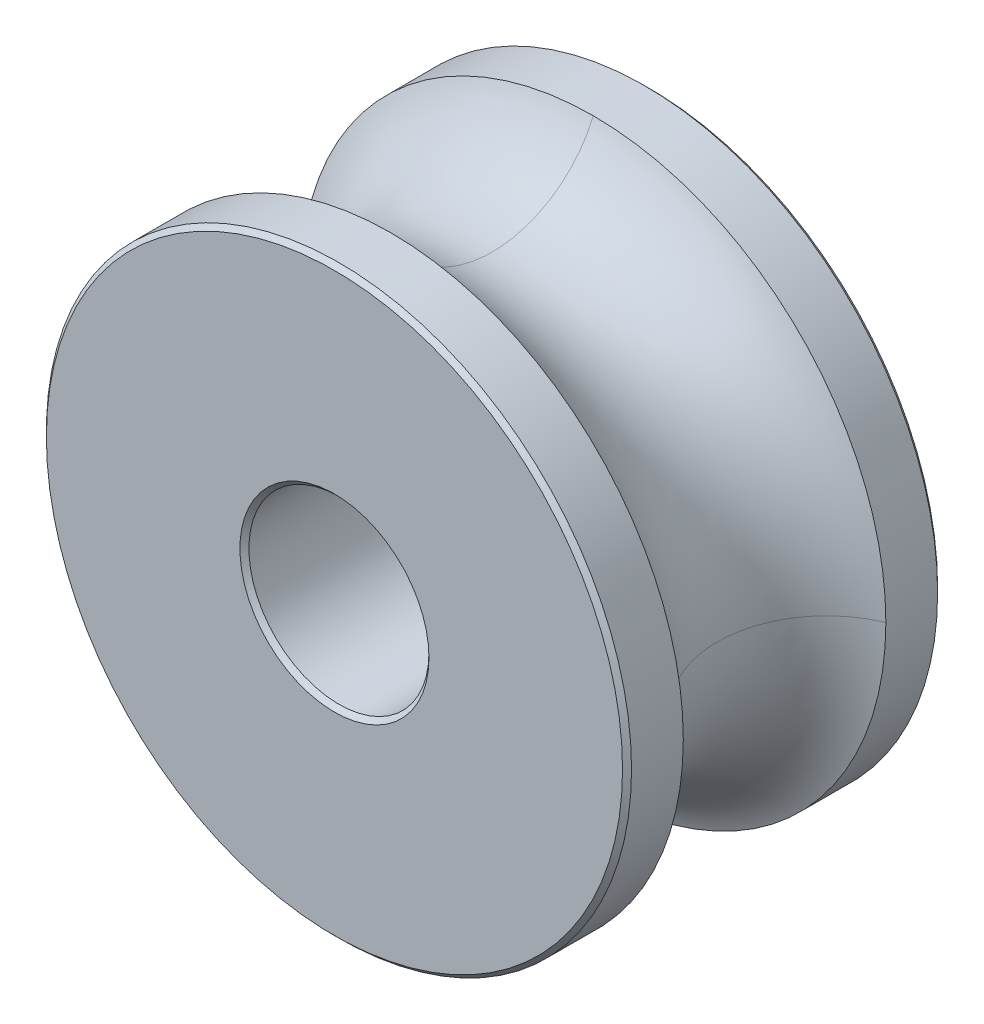
from build123d import *

# Parameters (mm, degrees)
SKETCH_1_R      = 6.5
SKETCH_1_R_2    = 2
EXTRUDE_1_DEPTH = 3.5
CHAMFER_1_SIZE  = 0.1


with BuildPart() as part:
    # 草图1 → 凸台-拉伸1 (new, symmetric)
    with BuildSketch(Plane.XY):
        Circle(SKETCH_1_R)
        Circle(SKETCH_1_R_2, mode=Mode.SUBTRACT)
    extrude(amount=EXTRUDE_1_DEPTH, both=True)

    # 切除-扫描1: sweep along a curve in space
    with BuildLine() as sweep_1_path:
        ThreePointArc((6.5, 0, -3.5), (4.596194078, 4.596194078, -3.5), (0, 6.5, -3.5))
        ThreePointArc((0, 6.5, -3.5), (-4.596194078, 4.596194078, -3.5), (-6.5, 0, -3.5))
        ThreePointArc((-6.5, 0, -3.5), (-4.596194078, -4.596194078, -3.5), (0, -6.5, -3.5))
        ThreePointArc((0, -6.5, -3.5), (4.596194078, -4.596194078, -3.5), (6.5, 0, -3.5))
    # 草图2 → 切除-扫描1 (sweep, cut)
    with BuildSketch(Plane(origin=(0, 0, 0), x_dir=(0, 0, -1), z_dir=(1, 0, 0))):
        with BuildLine():
            Line((-2.25, 6.5), (2.25, 6.5))
            ThreePointArc((2.25, 6.5), (0, 5), (-2.25, 6.5))
        make_face()
    sweep(path=sweep_1_path.line, mode=Mode.SUBTRACT)

    # 倒角1
    chamfer_1_edges = [part.edges().sort_by_distance(p)[0] for p in [
        (-6.5, 0, -3.5),
        (-6.5, 0, 3.5),
        (-2, 0, -3.5),
        (-2, 0, 3.5),
    ]]
    chamfer(chamfer_1_edges, length=CHAMFER_1_SIZE)


solid = part.part
